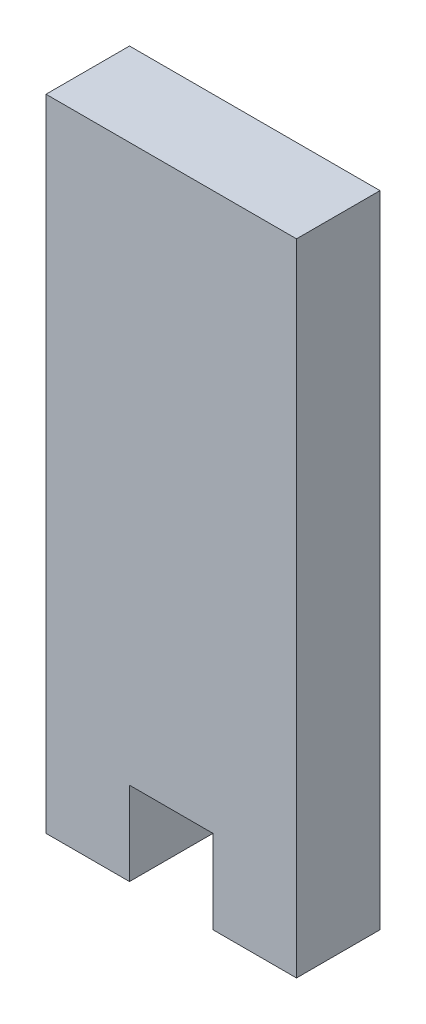
from build123d import *

# Parameters (mm, degrees)
BOSS_EXTRUDE1_DEPTH = 3


with BuildPart() as part:
    # Sketch2 → Boss-Extrude1 (new body)
    with BuildSketch(Plane.XY):
        Polygon((1.59530153, -5.537488078), (4.59530153, -5.537488078), (4.59530153, 17.462511922), (-4.40469847, 17.462511922), (-4.40469847, -5.537488078), (-1.40469847, -5.537488078), (-1.40469847, -2.537488078), (1.59530153, -2.537488078), align=None)
    extrude(amount=BOSS_EXTRUDE1_DEPTH)


solid = part.part
